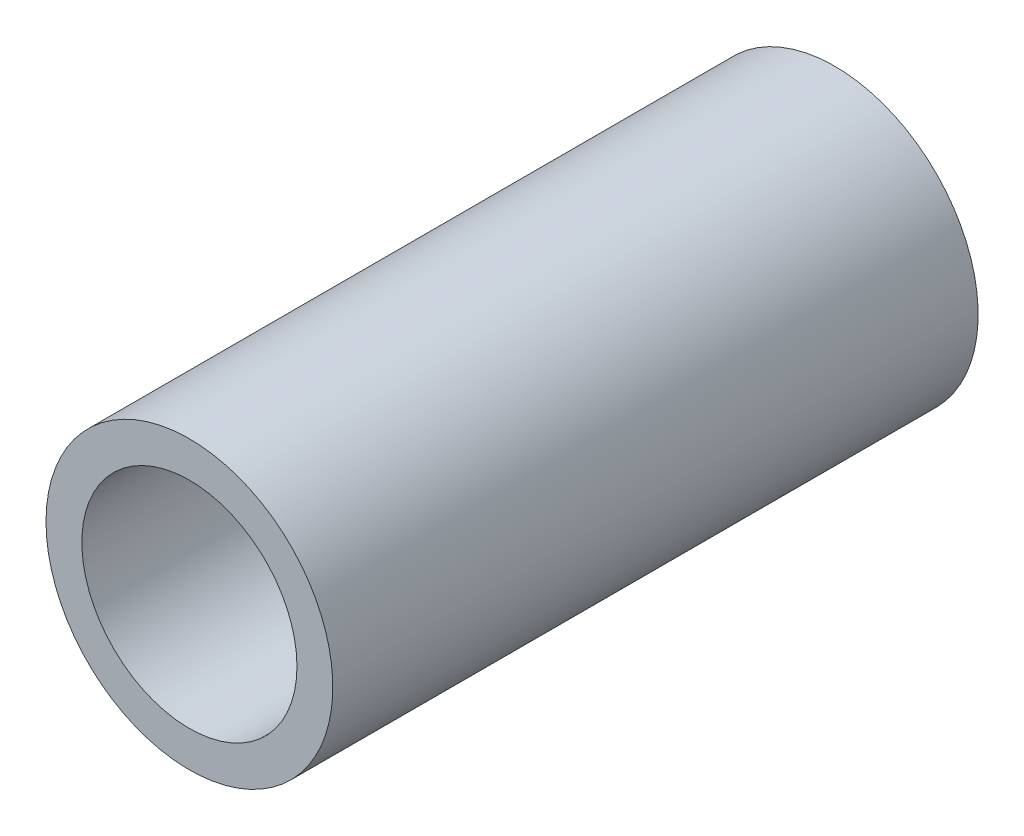
from build123d import *

# Parameters (mm, degrees)
SKETCH1_R           = 20
BOSS_EXTRUDE1_DEPTH = 90
SKETCH2_R           = 15
CUT_EXTRUDE1_DEPTH  = 90


with BuildPart() as part:
    # Sketch1 → Boss-Extrude1 (new body)
    with BuildSketch(Plane.XY):
        with Locations(Location((0, 0, 0), (0, 0, 180))):
            Circle(SKETCH1_R)
    extrude(amount=BOSS_EXTRUDE1_DEPTH)

    # Sketch2 → Cut-Extrude1 (cut)
    with BuildSketch(Plane.XY.offset(90)):
        Circle(SKETCH2_R)
    extrude(amount=-CUT_EXTRUDE1_DEPTH, mode=Mode.SUBTRACT)


solid = part.part
